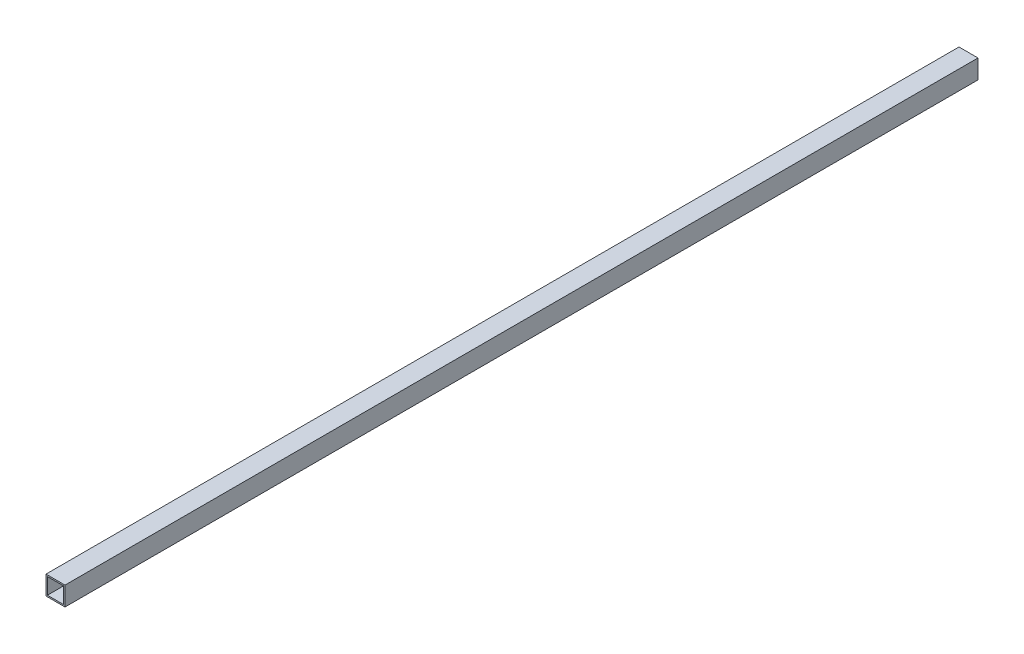
from build123d import *

# Parameters (mm, degrees)
SKETCH1_W           = 40
SKETCH1_H           = 40
BOSS_EXTRUDE1_DEPTH = 1920
SKETCH2_W           = 34
SKETCH2_H           = 34
CUT_EXTRUDE1_DEPTH  = 1920


with BuildPart() as part:
    # Sketch1 → Boss-Extrude1 (new body)
    with BuildSketch(Plane.XY):
        Rectangle(SKETCH1_W, SKETCH1_H)
    extrude(amount=BOSS_EXTRUDE1_DEPTH)

    # Sketch2 → Cut-Extrude1 (cut)
    with BuildSketch(Plane(origin=(0, 0, 0), x_dir=(-1, 0, 0), z_dir=(0, 0, -1))):
        Rectangle(SKETCH2_W, SKETCH2_H)
    extrude(amount=-CUT_EXTRUDE1_DEPTH, mode=Mode.SUBTRACT)


solid = part.part
